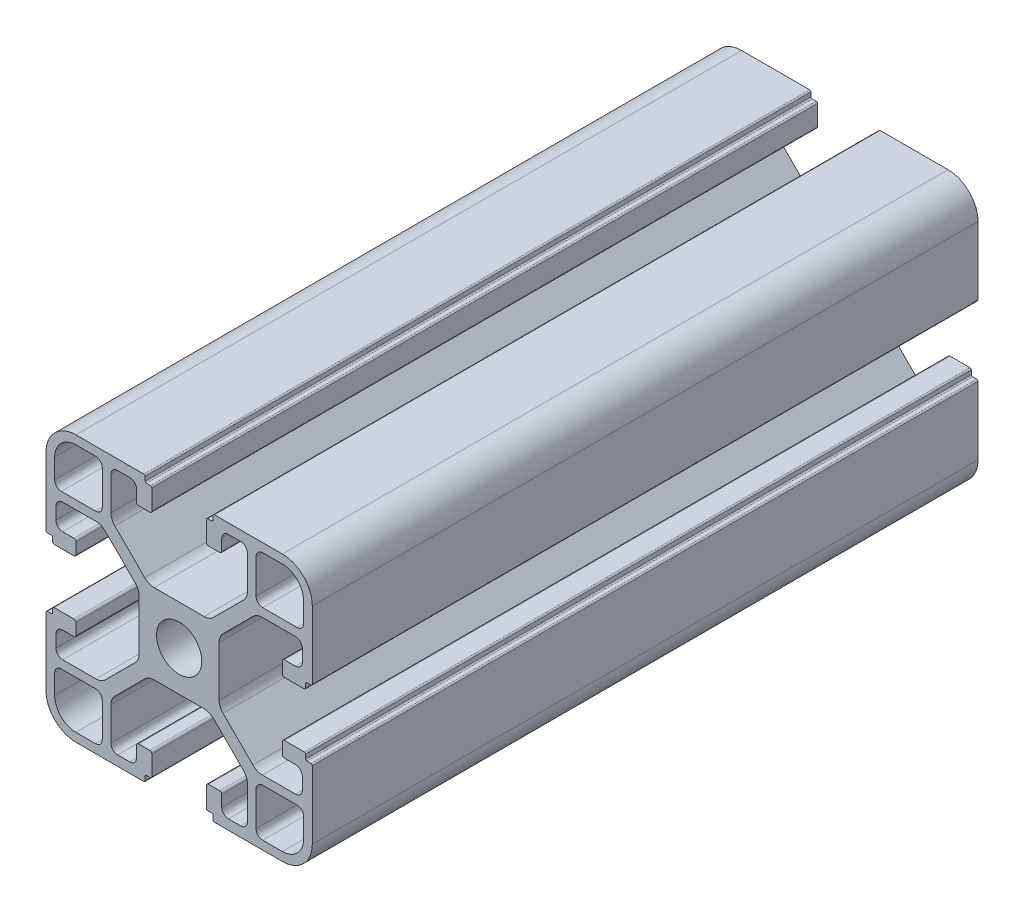
from build123d import *

# Parameters (mm, degrees)
SKETCH2_R           = 3.4
BOSS_EXTRUDE1_DEPTH = 100


with BuildPart() as part:
    # Sketch2 → Boss-Extrude1 (new body)
    with BuildSketch(Plane.XY):
        with BuildLine():
            Line((4.5, 0), (14.7, 0))
            ThreePointArc((14.7, 0), (14.841421356, 0.058578644), (14.9, 0.2))
            Line((14.9, 0.2), (14.9, 0.8))
            ThreePointArc((14.9, 0.8), (14.958578644, 0.941421356), (15.1, 1))
            Line((15.1, 1), (15.7, 1))
            ThreePointArc((15.7, 1), (15.841421356, 1.058578644), (15.9, 1.2))
            Line((15.9, 1.2), (15.9, 4.2))
            ThreePointArc((15.9, 4.2), (15.812132034, 4.412132034), (15.6, 4.5))
            Line((15.6, 4.5), (13.9, 4.5))
            ThreePointArc((13.9, 4.5), (13.687867966, 4.412132034), (13.6, 4.2))
            Line((13.6, 4.2), (13.6, 2.5))
            ThreePointArc((13.6, 2.5), (13.307106781, 1.792893219), (12.6, 1.5))
            Line((12.6, 1.5), (10.75, 1.5))
            ThreePointArc((10.75, 1.5), (10.042893219, 1.792893219), (9.75, 2.5))
            Line((9.75, 2.5), (9.75, 7.507359313))
            ThreePointArc((9.75, 7.507359313), (9.902240935, 8.272726178), (10.335786438, 8.921572875))
            Line((10.335786438, 8.921572875), (14.828427125, 13.414213562))
            ThreePointArc((14.828427125, 13.414213562), (15.477273822, 13.847759065), (16.242640687, 14))
            Line((16.242640687, 14), (23.757359313, 14))
            ThreePointArc((23.757359313, 14), (24.522726178, 13.847759065), (25.171572875, 13.414213562))
            Line((25.171572875, 13.414213562), (29.664213562, 8.921572875))
            ThreePointArc((29.664213562, 8.921572875), (30.097759065, 8.272726178), (30.25, 7.507359313))
            Line((30.25, 7.507359313), (30.25, 2.5))
            ThreePointArc((30.25, 2.5), (29.957106781, 1.792893219), (29.25, 1.5))
            Line((29.25, 1.5), (27.4, 1.5))
            ThreePointArc((27.4, 1.5), (26.692893219, 1.792893219), (26.4, 2.5))
            Line((26.4, 2.5), (26.4, 4.2))
            ThreePointArc((26.4, 4.2), (26.312132034, 4.412132034), (26.1, 4.5))
            Line((26.1, 4.5), (24.4, 4.5))
            ThreePointArc((24.4, 4.5), (24.187867966, 4.412132034), (24.1, 4.2))
            Line((24.1, 4.2), (24.1, 1.2))
            ThreePointArc((24.1, 1.2), (24.158578644, 1.058578644), (24.3, 1))
            Line((24.3, 1), (24.9, 1))
            ThreePointArc((24.9, 1), (25.041421356, 0.941421356), (25.1, 0.8))
            Line((25.1, 0.8), (25.1, 0.2))
            ThreePointArc((25.1, 0.2), (25.158578644, 0.058578644), (25.3, 0))
            Line((25.3, 0), (35.5, 0))
            ThreePointArc((35.5, 0), (38.681980515, 1.318019485), (40, 4.5))
            Line((40, 4.5), (40, 14.7))
            ThreePointArc((40, 14.7), (39.941421356, 14.841421356), (39.8, 14.9))
            Line((39.8, 14.9), (39.2, 14.9))
            ThreePointArc((39.2, 14.9), (39.058578644, 14.958578644), (39, 15.1))
            Line((39, 15.1), (39, 15.7))
            ThreePointArc((39, 15.7), (38.941421356, 15.841421356), (38.8, 15.9))
            Line((38.8, 15.9), (35.8, 15.9))
            ThreePointArc((35.8, 15.9), (35.587867966, 15.812132034), (35.5, 15.6))
            Line((35.5, 15.6), (35.5, 13.9))
            ThreePointArc((35.5, 13.9), (35.587867966, 13.687867966), (35.8, 13.6))
            Line((35.8, 13.6), (37.5, 13.6))
            ThreePointArc((37.5, 13.6), (38.207106781, 13.307106781), (38.5, 12.6))
            Line((38.5, 12.6), (38.5, 10.75))
            ThreePointArc((38.5, 10.75), (38.207106781, 10.042893219), (37.5, 9.75))
            Line((37.5, 9.75), (32.492640687, 9.75))
            ThreePointArc((32.492640687, 9.75), (31.727273822, 9.902240935), (31.078427125, 10.335786438))
            Line((31.078427125, 10.335786438), (26.585786438, 14.828427125))
            ThreePointArc((26.585786438, 14.828427125), (26.152240935, 15.477273822), (26, 16.242640687))
            Line((26, 16.242640687), (26, 23.757359313))
            ThreePointArc((26, 23.757359313), (26.152240935, 24.522726178), (26.585786438, 25.171572875))
            Line((26.585786438, 25.171572875), (31.078427125, 29.664213562))
            ThreePointArc((31.078427125, 29.664213562), (31.727273822, 30.097759065), (32.492640687, 30.25))
            Line((32.492640687, 30.25), (37.5, 30.25))
            ThreePointArc((37.5, 30.25), (38.207106781, 29.957106781), (38.5, 29.25))
            Line((38.5, 29.25), (38.5, 27.4))
            ThreePointArc((38.5, 27.4), (38.207106781, 26.692893219), (37.5, 26.4))
            Line((37.5, 26.4), (35.8, 26.4))
            ThreePointArc((35.8, 26.4), (35.587867966, 26.312132034), (35.5, 26.1))
            Line((35.5, 26.1), (35.5, 24.4))
            ThreePointArc((35.5, 24.4), (35.587867966, 24.187867966), (35.8, 24.1))
            Line((35.8, 24.1), (38.8, 24.1))
            ThreePointArc((38.8, 24.1), (38.941421356, 24.158578644), (39, 24.3))
            Line((39, 24.3), (39, 24.9))
            ThreePointArc((39, 24.9), (39.058578644, 25.041421356), (39.2, 25.1))
            Line((39.2, 25.1), (39.8, 25.1))
            ThreePointArc((39.8, 25.1), (39.941421356, 25.158578644), (40, 25.3))
            Line((40, 25.3), (40, 35.5))
            ThreePointArc((40, 35.5), (38.681980515, 38.681980515), (35.5, 40))
            Line((35.5, 40), (25.3, 40))
            ThreePointArc((25.3, 40), (25.158578644, 39.941421356), (25.1, 39.8))
            Line((25.1, 39.8), (25.1, 39.2))
            ThreePointArc((25.1, 39.2), (25.041421356, 39.058578644), (24.9, 39))
            Line((24.9, 39), (24.3, 39))
            ThreePointArc((24.3, 39), (24.158578644, 38.941421356), (24.1, 38.8))
            Line((24.1, 38.8), (24.1, 35.8))
            ThreePointArc((24.1, 35.8), (24.187867966, 35.587867966), (24.4, 35.5))
            Line((24.4, 35.5), (26.1, 35.5))
            ThreePointArc((26.1, 35.5), (26.312132034, 35.587867966), (26.4, 35.8))
            Line((26.4, 35.8), (26.4, 37.5))
            ThreePointArc((26.4, 37.5), (26.692893219, 38.207106781), (27.4, 38.5))
            Line((27.4, 38.5), (29.25, 38.5))
            ThreePointArc((29.25, 38.5), (29.957106781, 38.207106781), (30.25, 37.5))
            Line((30.25, 37.5), (30.25, 32.492640687))
            ThreePointArc((30.25, 32.492640687), (30.097759065, 31.727273822), (29.664213562, 31.078427125))
            Line((29.664213562, 31.078427125), (25.171572875, 26.585786438))
            ThreePointArc((25.171572875, 26.585786438), (24.522726178, 26.152240935), (23.757359313, 26))
            Line((23.757359313, 26), (16.242640687, 26))
            ThreePointArc((16.242640687, 26), (15.477273822, 26.152240935), (14.828427125, 26.585786438))
            Line((14.828427125, 26.585786438), (10.335786438, 31.078427125))
            ThreePointArc((10.335786438, 31.078427125), (9.902240935, 31.727273822), (9.75, 32.492640687))
            Line((9.75, 32.492640687), (9.75, 37.5))
            ThreePointArc((9.75, 37.5), (10.042893219, 38.207106781), (10.75, 38.5))
            Line((10.75, 38.5), (12.6, 38.5))
            ThreePointArc((12.6, 38.5), (13.307106781, 38.207106781), (13.6, 37.5))
            Line((13.6, 37.5), (13.6, 35.8))
            ThreePointArc((13.6, 35.8), (13.687867966, 35.587867966), (13.9, 35.5))
            Line((13.9, 35.5), (15.6, 35.5))
            ThreePointArc((15.6, 35.5), (15.812132034, 35.587867966), (15.9, 35.8))
            Line((15.9, 35.8), (15.9, 38.8))
            ThreePointArc((15.9, 38.8), (15.841421356, 38.941421356), (15.7, 39))
            Line((15.7, 39), (15.1, 39))
            ThreePointArc((15.1, 39), (14.958578644, 39.058578644), (14.9, 39.2))
            Line((14.9, 39.2), (14.9, 39.8))
            ThreePointArc((14.9, 39.8), (14.841421356, 39.941421356), (14.7, 40))
            Line((14.7, 40), (4.5, 40))
            ThreePointArc((4.5, 40), (1.318019485, 38.681980515), (0, 35.5))
            Line((0, 35.5), (0, 25.3))
            ThreePointArc((0, 25.3), (0.058578644, 25.158578644), (0.2, 25.1))
            Line((0.2, 25.1), (0.8, 25.1))
            ThreePointArc((0.8, 25.1), (0.941421356, 25.041421356), (1, 24.9))
            Line((1, 24.9), (1, 24.3))
            ThreePointArc((1, 24.3), (1.058578644, 24.158578644), (1.2, 24.1))
            Line((1.2, 24.1), (4.2, 24.1))
            ThreePointArc((4.2, 24.1), (4.412132034, 24.187867966), (4.5, 24.4))
            Line((4.5, 24.4), (4.5, 26.1))
            ThreePointArc((4.5, 26.1), (4.412132034, 26.312132034), (4.2, 26.4))
            Line((4.2, 26.4), (2.5, 26.4))
            ThreePointArc((2.5, 26.4), (1.792893219, 26.692893219), (1.5, 27.4))
            Line((1.5, 27.4), (1.5, 29.25))
            ThreePointArc((1.5, 29.25), (1.792893219, 29.957106781), (2.5, 30.25))
            Line((2.5, 30.25), (7.507359313, 30.25))
            ThreePointArc((7.507359313, 30.25), (8.272726178, 30.097759065), (8.921572875, 29.664213562))
            Line((8.921572875, 29.664213562), (13.414213562, 25.171572875))
            ThreePointArc((13.414213562, 25.171572875), (13.847759065, 24.522726178), (14, 23.757359313))
            Line((14, 23.757359313), (14, 16.242640687))
            ThreePointArc((14, 16.242640687), (13.847759065, 15.477273822), (13.414213562, 14.828427125))
            Line((13.414213562, 14.828427125), (8.921572875, 10.335786438))
            ThreePointArc((8.921572875, 10.335786438), (8.272726178, 9.902240935), (7.507359313, 9.75))
            Line((7.507359313, 9.75), (2.5, 9.75))
            ThreePointArc((2.5, 9.75), (1.792893219, 10.042893219), (1.5, 10.75))
            Line((1.5, 10.75), (1.5, 12.6))
            ThreePointArc((1.5, 12.6), (1.792893219, 13.307106781), (2.5, 13.6))
            Line((2.5, 13.6), (4.2, 13.6))
            ThreePointArc((4.2, 13.6), (4.412132034, 13.687867966), (4.5, 13.9))
            Line((4.5, 13.9), (4.5, 15.6))
            ThreePointArc((4.5, 15.6), (4.412132034, 15.812132034), (4.2, 15.9))
            Line((4.2, 15.9), (1.2, 15.9))
            ThreePointArc((1.2, 15.9), (1.058578644, 15.841421356), (1, 15.7))
            Line((1, 15.7), (1, 15.1))
            ThreePointArc((1, 15.1), (0.941421356, 14.958578644), (0.8, 14.9))
            Line((0.8, 14.9), (0.2, 14.9))
            ThreePointArc((0.2, 14.9), (0.058578644, 14.841421356), (0, 14.7))
            Line((0, 14.7), (0, 4.5))
            ThreePointArc((0, 4.5), (1.318019485, 1.318019485), (4.5, 0))
        make_face()
        with Locations((20, 20)):
            Circle(SKETCH2_R, mode=Mode.SUBTRACT)
        with BuildLine():
            Line((31.55, 37.7), (31.55, 32.55))
            ThreePointArc((31.55, 32.55), (31.842893219, 31.842893219), (32.55, 31.55))
            Line((32.55, 31.55), (37.7, 31.55))
            ThreePointArc((37.7, 31.55), (38.407106781, 31.842893219), (38.7, 32.55))
            Line((38.7, 32.55), (38.7, 35.5))
            ThreePointArc((38.7, 35.5), (37.7627417, 37.7627417), (35.5, 38.7))
            Line((35.5, 38.7), (32.55, 38.7))
            ThreePointArc((32.55, 38.7), (31.842893219, 38.407106781), (31.55, 37.7))
        make_face(mode=Mode.SUBTRACT)
        with BuildLine():
            Line((1.3, 35.5), (1.3, 32.55))
            ThreePointArc((1.3, 32.55), (1.592893219, 31.842893219), (2.3, 31.55))
            Line((2.3, 31.55), (7.45, 31.55))
            ThreePointArc((7.45, 31.55), (8.157106781, 31.842893219), (8.45, 32.55))
            Line((8.45, 32.55), (8.45, 37.7))
            ThreePointArc((8.45, 37.7), (8.157106781, 38.407106781), (7.45, 38.7))
            Line((7.45, 38.7), (4.5, 38.7))
            ThreePointArc((4.5, 38.7), (2.2372583, 37.7627417), (1.3, 35.5))
        make_face(mode=Mode.SUBTRACT)
        with BuildLine():
            Line((1.3, 7.45), (1.3, 4.5))
            ThreePointArc((1.3, 4.5), (2.2372583, 2.2372583), (4.5, 1.3))
            Line((4.5, 1.3), (7.45, 1.3))
            ThreePointArc((7.45, 1.3), (8.157106781, 1.592893219), (8.45, 2.3))
            Line((8.45, 2.3), (8.45, 7.45))
            ThreePointArc((8.45, 7.45), (8.157106781, 8.157106781), (7.45, 8.45))
            Line((7.45, 8.45), (2.3, 8.45))
            ThreePointArc((2.3, 8.45), (1.592893219, 8.157106781), (1.3, 7.45))
        make_face(mode=Mode.SUBTRACT)
        with BuildLine():
            Line((31.55, 7.45), (31.55, 2.3))
            ThreePointArc((31.55, 2.3), (31.842893219, 1.592893219), (32.55, 1.3))
            Line((32.55, 1.3), (35.5, 1.3))
            ThreePointArc((35.5, 1.3), (37.7627417, 2.2372583), (38.7, 4.5))
            Line((38.7, 4.5), (38.7, 7.45))
            ThreePointArc((38.7, 7.45), (38.407106781, 8.157106781), (37.7, 8.45))
            Line((37.7, 8.45), (32.55, 8.45))
            ThreePointArc((32.55, 8.45), (31.842893219, 8.157106781), (31.55, 7.45))
        make_face(mode=Mode.SUBTRACT)
    extrude(amount=BOSS_EXTRUDE1_DEPTH)


solid = part.part
